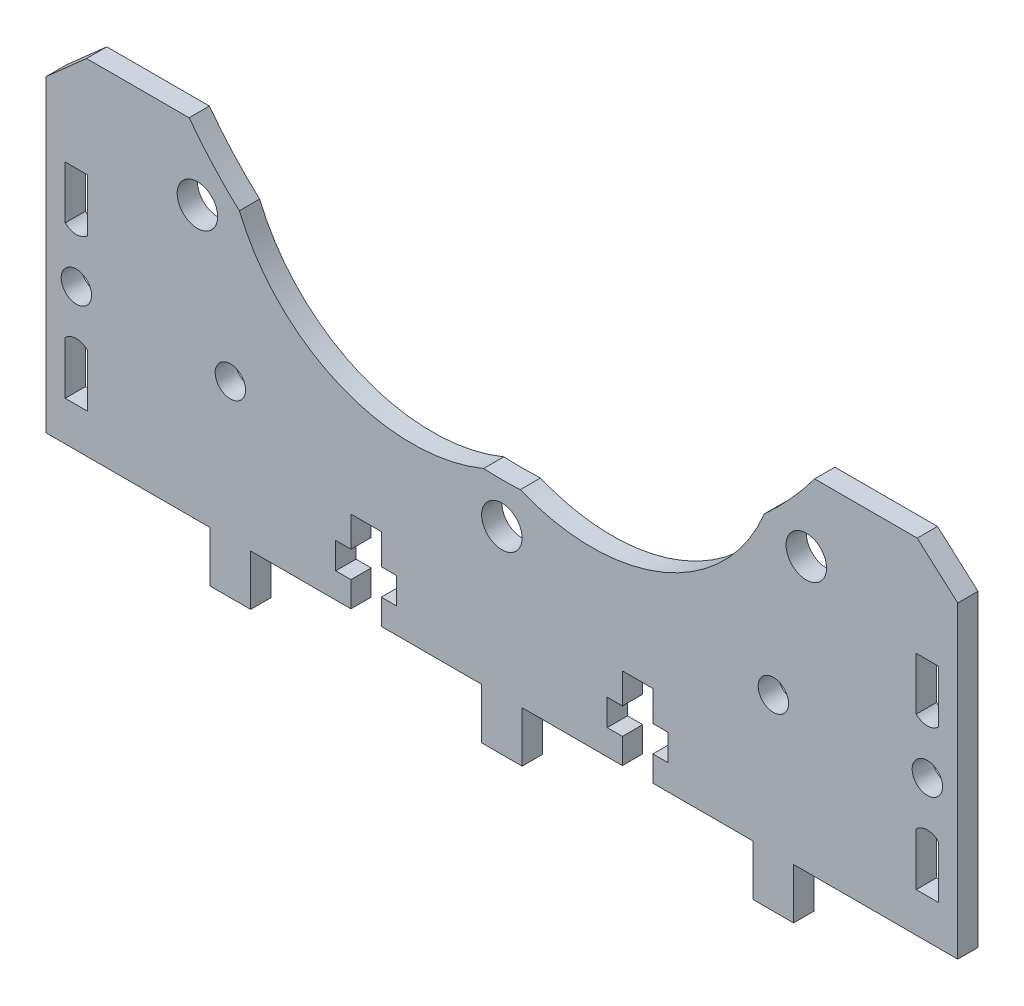
from build123d import *

# Parameters (mm, degrees)
SKETCH_3_R      = 2
SKETCH_3_R_2    = 1.5
EXTRUDE_1_DEPTH = 2


with BuildPart() as part:
    # 草图3 → 凸台-拉伸1 (new body)
    with BuildSketch(Plane.XY):
        with BuildLine():
            Line((-45, -3.990216685), (-28.8, -3.990216685))
            Line((-28.8, -3.990216685), (-28.8, -8.990216685))
            Line((-28.8, -8.990216685), (-24.8, -8.990216685))
            Line((-24.8, -8.990216685), (-24.8, -3.990216685))
            Line((-24.8, -3.990216685), (-14.9, -3.990216685))
            Line((-14.9, -3.990216685), (-14.9, -1.490216685))
            Line((-14.9, -1.490216685), (-16.4, -1.490216685))
            Line((-16.4, -1.490216685), (-16.4, 1.109783315))
            Line((-16.4, 1.109783315), (-14.9, 1.109783315))
            Line((-14.9, 1.109783315), (-14.9, 4.109783315))
            Line((-14.9, 4.109783315), (-11.9, 4.109783315))
            Line((-11.9, 4.109783315), (-11.9, 1.109783315))
            Line((-11.9, 1.109783315), (-10.4, 1.109783315))
            Line((-10.4, 1.109783315), (-10.4, -1.490216685))
            Line((-10.4, -1.490216685), (-11.9, -1.490216685))
            Line((-11.9, -1.490216685), (-11.9, -3.990216685))
            Line((-11.9, -3.990216685), (-2, -3.990216685))
            Line((-2, -3.990216685), (-2, -8.990216685))
            Line((-2, -8.990216685), (0, -8.990216685))
            Line((0, -8.990216685), (2, -8.990216685))
            Line((2, -8.990216685), (2, -3.990216685))
            Line((2, -3.990216685), (11.9, -3.990216685))
            Line((11.9, -3.990216685), (11.9, -1.490216685))
            Line((11.9, -1.490216685), (10.4, -1.490216685))
            Line((10.4, -1.490216685), (10.4, 1.109783315))
            Line((10.4, 1.109783315), (11.9, 1.109783315))
            Line((11.9, 1.109783315), (11.9, 4.109783315))
            Line((11.9, 4.109783315), (14.9, 4.109783315))
            Line((14.9, 4.109783315), (14.9, 1.109783315))
            Line((14.9, 1.109783315), (16.4, 1.109783315))
            Line((16.4, 1.109783315), (16.4, -1.490216685))
            Line((16.4, -1.490216685), (14.9, -1.490216685))
            Line((14.9, -1.490216685), (14.9, -3.990216685))
            Line((14.9, -3.990216685), (24.8, -3.990216685))
            Line((24.8, -3.990216685), (24.8, -8.990216685))
            Line((24.8, -8.990216685), (28.8, -8.990216685))
            Line((28.8, -8.990216685), (28.8, -3.990216685))
            Line((28.8, -3.990216685), (45, -3.990216685))
            Line((45, -3.990216685), (45, 5.009783315))
            Line((45, 5.009783315), (45, 15.009783315))
            Line((45, 15.009783315), (45, 26.463053661))
            Line((45, 26.463053661), (41, 30.009783315))
            Line((41, 30.009783315), (30.874746963, 30.009783315))
            ThreePointArc((30.874746963, 30.009783315), (28.525350528, 27.153364822), (25.912710857, 24.535559602))
            ThreePointArc((25.912710857, 24.535559602), (15.928828372, 14.55206683), (1.809761925, 14.552342399))
            ThreePointArc((1.809761925, 14.552342399), (0, 14.509783315), (-1.809761925, 14.552342399))
            ThreePointArc((-1.809761925, 14.552342399), (-15.928828372, 14.55206683), (-25.912710857, 24.535559602))
            ThreePointArc((-25.912710857, 24.535559602), (-28.525350528, 27.153364822), (-30.874746963, 30.009783315))
            Line((-30.874746963, 30.009783315), (-41, 30.009783315))
            Line((-41, 30.009783315), (-45, 26.463053661))
            Line((-45, 26.463053661), (-45, 15.009783315))
            Line((-45, 15.009783315), (-45, 5.009783315))
            Line((-45, 5.009783315), (-45, -3.990216685))
        make_face()
        with Locations((0, 10.509783315)):
            Circle(SKETCH_3_R, mode=Mode.SUBTRACT)
        with Locations((-30.0520382, 22.957745114)):
            Circle(SKETCH_3_R, mode=Mode.SUBTRACT)
        with Locations((30.0520382, 22.957745114)):
            Circle(SKETCH_3_R, mode=Mode.SUBTRACT)
        with Locations((-26.8, 9.509783315)):
            Circle(SKETCH_3_R_2, mode=Mode.SUBTRACT)
        with Locations(Location((26.8, 9.509783315, 0), (0, 0, 180))):
            Circle(SKETCH_3_R_2, mode=Mode.SUBTRACT)
        with Locations((-42, 10.009783315)):
            Circle(SKETCH_3_R_2, mode=Mode.SUBTRACT)
        with Locations(Location((42, 10.009783315, 0), (0, 0, 180))):
            Circle(SKETCH_3_R_2, mode=Mode.SUBTRACT)
        with BuildLine():
            Line((-43.1, 5.109783315), (-43.1, -0.090216685))
            Line((-43.1, -0.090216685), (-40.9, -0.090216685))
            Line((-40.9, -0.090216685), (-40.9, 5.109783315))
            ThreePointArc((-40.9, 5.109783315), (-42, 5.565418233), (-43.1, 5.109783315))
        make_face(mode=Mode.SUBTRACT)
        with BuildLine():
            Line((-43.1, 20.109783315), (-40.9, 20.109783315))
            Line((-40.9, 20.109783315), (-40.9, 14.909783315))
            ThreePointArc((-40.9, 14.909783315), (-42, 14.454148396), (-43.1, 14.909783315))
            Line((-43.1, 14.909783315), (-43.1, 20.109783315))
        make_face(mode=Mode.SUBTRACT)
        with BuildLine():
            Line((40.9, 20.109783315), (40.9, 14.909783315))
            ThreePointArc((40.9, 14.909783315), (42, 14.454148396), (43.1, 14.909783315))
            Line((43.1, 14.909783315), (43.1, 20.109783315))
            Line((43.1, 20.109783315), (40.9, 20.109783315))
        make_face(mode=Mode.SUBTRACT)
        with BuildLine():
            Line((40.9, 5.109783315), (40.9, -0.090216685))
            Line((40.9, -0.090216685), (43.1, -0.090216685))
            Line((43.1, -0.090216685), (43.1, 5.109783315))
            ThreePointArc((43.1, 5.109783315), (42, 5.565418233), (40.9, 5.109783315))
        make_face(mode=Mode.SUBTRACT)
    extrude(amount=EXTRUDE_1_DEPTH)


solid = part.part
